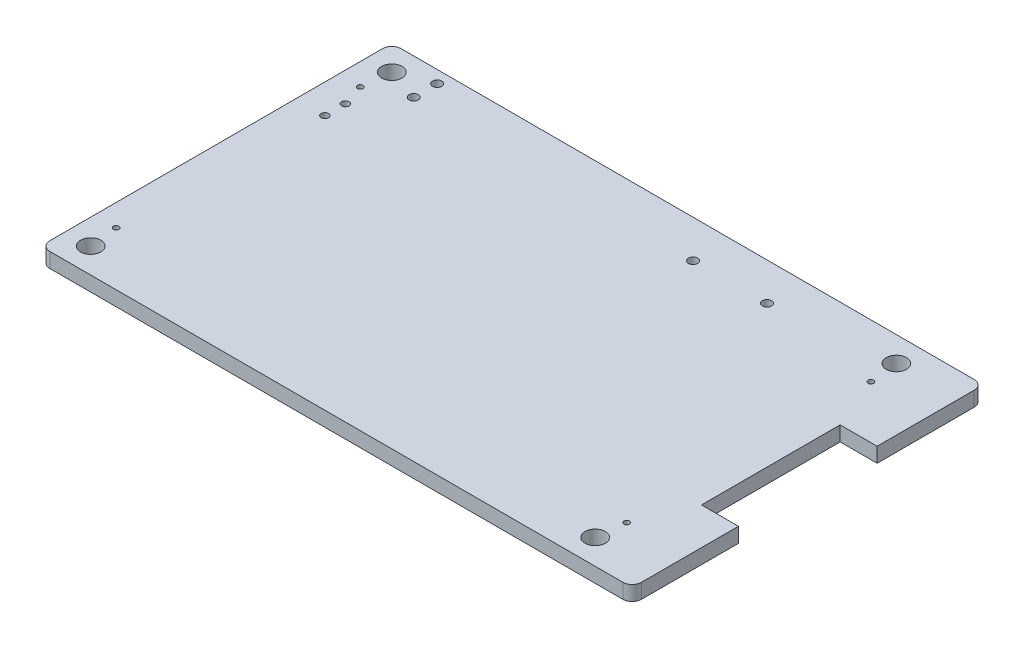
from build123d import *

# Parameters (mm, degrees)
SKETCH1_R           = 0.2999994
SKETCH1_R_2         = 1.1
SKETCH1_R_3         = 0.499999
SKETCH1_R_4         = 0.3999992
BOSS_EXTRUDE1_DEPTH = 1.6


with BuildPart() as part:
    # Sketch1 → Boss-Extrude1 (new body)
    with BuildSketch(Plane(origin=(0, 0, 0), x_dir=(1, 0, 0), z_dir=(0, 1, 0))):
        with BuildLine():
            Line((34, -18), (34, -7.5))
            Line((34, -7.5), (30, -7.5))
            Line((30, -7.5), (30, 7.5))
            Line((30, 7.5), (34, 7.5))
            Line((34, 7.5), (34, 18))
            ThreePointArc((34, 18), (33.707106781, 18.707106781), (33, 19))
            Line((33, 19), (-29, 19))
            ThreePointArc((-29, 19), (-29.707106781, 18.707106781), (-30, 18))
            Line((-30, 18), (-30, -18))
            ThreePointArc((-30, -18), (-29.707106781, -18.707106781), (-29, -19))
            Line((-29, -19), (33, -19))
            ThreePointArc((33, -19), (33.707106781, -18.707106781), (34, -18))
        make_face()
        with Locations(Location((27.62000064, 13.199999, 0), (0, 0, 90))):
            Circle(SKETCH1_R, mode=Mode.SUBTRACT)
        with Locations(Location((27.28999876, -16.29000044, 0), (0, 0, 90))):
            Circle(SKETCH1_R_2, mode=Mode.SUBTRACT)
        with Locations(Location((27.62000064, -13.199999, 0), (0, 0, 90))):
            Circle(SKETCH1_R, mode=Mode.SUBTRACT)
        with Locations(Location((14.65628514, 14.92444056, 0), (0, 0, 90))):
            Circle(SKETCH1_R_3, mode=Mode.SUBTRACT)
        with Locations(Location((27.28999876, 16.29000044, 0), (0, 0, 90))):
            Circle(SKETCH1_R_2, mode=Mode.SUBTRACT)
        with Locations(Location((6.6676143, 14.9207728, 0), (0, 0, 90))):
            Circle(SKETCH1_R_3, mode=Mode.SUBTRACT)
        with Locations(Location((-23.75582498, 15.12569238, 0), (0, 0, 90))):
            Circle(SKETCH1_R_3, mode=Mode.SUBTRACT)
        with Locations(Location((-26.84364202, 8.59971356, 0), (0, 0, 90))):
            Circle(SKETCH1_R_4, mode=Mode.SUBTRACT)
        with Locations(Location((-27.28999876, -16.29000044, 0), (0, 0, 90))):
            Circle(SKETCH1_R_2, mode=Mode.SUBTRACT)
        with Locations(Location((-27.62000064, -13.199999, 0), (0, 0, 90))):
            Circle(SKETCH1_R, mode=Mode.SUBTRACT)
        with Locations(Location((-26.84364202, 10.8197142, 0), (0, 0, 90))):
            Circle(SKETCH1_R_4, mode=Mode.SUBTRACT)
        with Locations(Location((-23.75582498, 17.66569238, 0), (0, 0, 90))):
            Circle(SKETCH1_R_3, mode=Mode.SUBTRACT)
        with Locations(Location((-27.62000064, 13.199999, 0), (0, 0, 90))):
            Circle(SKETCH1_R, mode=Mode.SUBTRACT)
        with Locations(Location((-27.28999876, 16.29000044, 0), (0, 0, 90))):
            Circle(SKETCH1_R_2, mode=Mode.SUBTRACT)
    extrude(amount=-BOSS_EXTRUDE1_DEPTH)


solid = part.part
